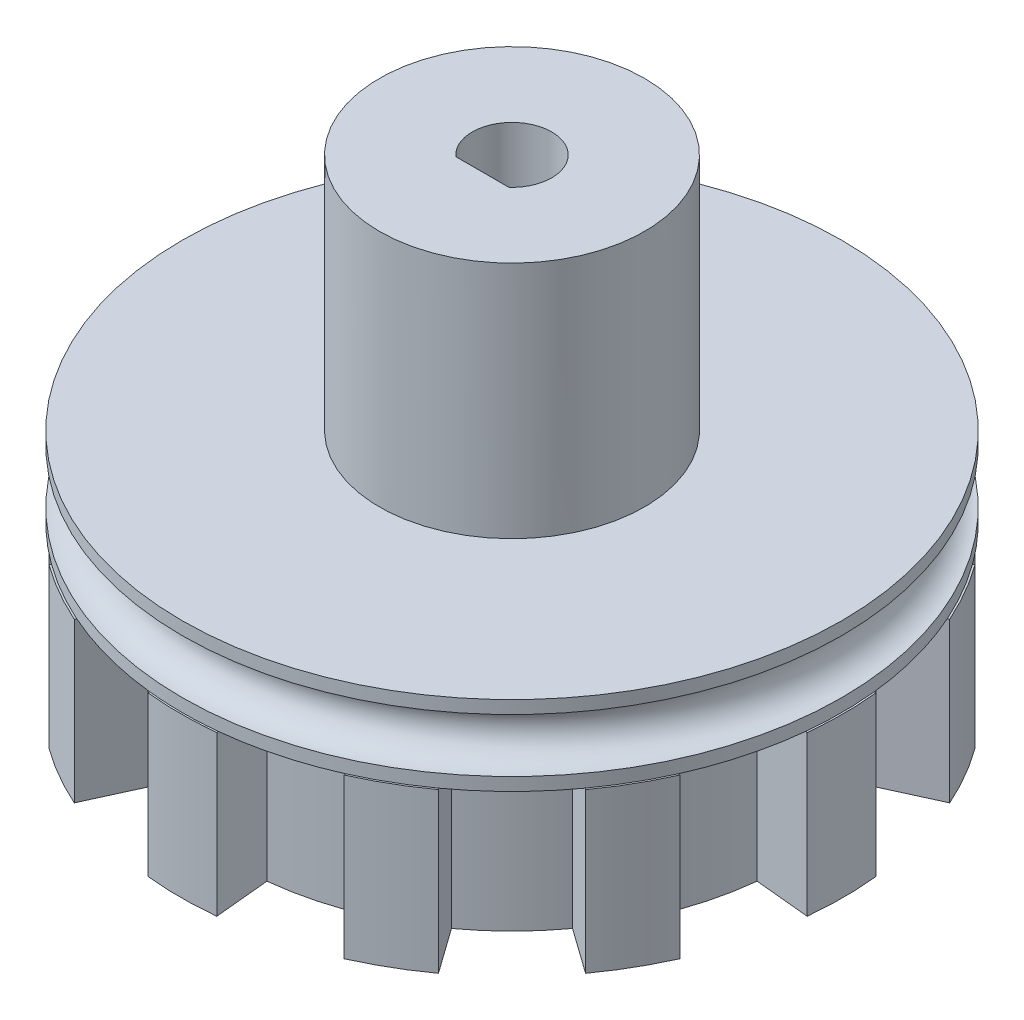
from build123d import *

# Parameters (mm, degrees)
EXTRUDE_1_DEPTH     = 6
SKETCH_3_R          = 1.4
CUT_EXTRUDE_1_DEPTH = 6
SKETCH_4_R          = 5
EXTRUDE_2_DEPTH     = 12
CUT_EXTRUDE_2_DEPTH = 12


with BuildPart() as part:
    # 草图2 → 凸台-拉伸1 (new body)
    with BuildSketch(Plane(origin=(0, 0, 0), x_dir=(1, 0, 0), z_dir=(0, 1, 0))):
        with BuildLine():
            Line((-1.1, 10.341663309), (-1.3, 12.432216214))
            ThreePointArc((-1.3, 12.432216214), (0, 12.5), (1.3, 12.432216214))
            Line((1.3, 12.432216214), (1.1, 10.341663309))
            ThreePointArc((1.1, 10.341663309), (2.691718069, 10.045628593), (4.21820371, 9.506143143))
            Line((4.21820371, 9.506143143), (5.090275082, 11.416615067))
            ThreePointArc((5.090275082, 11.416615067), (6.25, 10.825317547), (7.341941132, 10.116615067))
            Line((7.341941132, 10.116615067), (6.123459599, 8.406143143))
            ThreePointArc((6.123459599, 8.406143143), (7.353910524, 7.353910524), (8.406143143, 6.123459599))
            Line((8.406143143, 6.123459599), (10.116615067, 7.341941132))
            ThreePointArc((10.116615067, 7.341941132), (10.825317547, 6.25), (11.416615067, 5.090275082))
            Line((11.416615067, 5.090275082), (9.506143143, 4.21820371))
            ThreePointArc((9.506143143, 4.21820371), (10.045628593, 2.691718069), (10.341663309, 1.1))
            Line((10.341663309, 1.1), (12.432216214, 1.3))
            ThreePointArc((12.432216214, 1.3), (12.5, 0), (12.432216214, -1.3))
            Line((12.432216214, -1.3), (10.341663309, -1.1))
            ThreePointArc((10.341663309, -1.1), (10.045628593, -2.691718069), (9.506143143, -4.21820371))
            Line((9.506143143, -4.21820371), (11.416615067, -5.090275082))
            ThreePointArc((11.416615067, -5.090275082), (10.825317547, -6.25), (10.116615067, -7.341941132))
            Line((10.116615067, -7.341941132), (8.406143143, -6.123459599))
            ThreePointArc((8.406143143, -6.123459599), (7.353910524, -7.353910524), (6.123459599, -8.406143143))
            Line((6.123459599, -8.406143143), (7.341941132, -10.116615067))
            ThreePointArc((7.341941132, -10.116615067), (6.25, -10.825317547), (5.090275082, -11.416615067))
            Line((5.090275082, -11.416615067), (4.21820371, -9.506143143))
            ThreePointArc((4.21820371, -9.506143143), (2.691718069, -10.045628593), (1.1, -10.341663309))
            Line((1.1, -10.341663309), (1.3, -12.432216214))
            ThreePointArc((1.3, -12.432216214), (0, -12.5), (-1.3, -12.432216214))
            Line((-1.3, -12.432216214), (-1.1, -10.341663309))
            ThreePointArc((-1.1, -10.341663309), (-2.691718069, -10.045628593), (-4.21820371, -9.506143143))
            Line((-4.21820371, -9.506143143), (-5.090275082, -11.416615067))
            ThreePointArc((-5.090275082, -11.416615067), (-6.25, -10.825317547), (-7.341941132, -10.116615067))
            Line((-7.341941132, -10.116615067), (-6.123459599, -8.406143143))
            ThreePointArc((-6.123459599, -8.406143143), (-7.353910524, -7.353910524), (-8.406143143, -6.123459599))
            Line((-8.406143143, -6.123459599), (-10.116615067, -7.341941132))
            ThreePointArc((-10.116615067, -7.341941132), (-10.825317547, -6.25), (-11.416615067, -5.090275082))
            Line((-11.416615067, -5.090275082), (-9.506143143, -4.21820371))
            ThreePointArc((-9.506143143, -4.21820371), (-10.045628593, -2.691718069), (-10.341663309, -1.1))
            Line((-10.341663309, -1.1), (-12.432216214, -1.3))
            ThreePointArc((-12.432216214, -1.3), (-12.5, 0), (-12.432216214, 1.3))
            Line((-12.432216214, 1.3), (-10.341663309, 1.1))
            ThreePointArc((-10.341663309, 1.1), (-10.045628593, 2.691718069), (-9.506143143, 4.21820371))
            Line((-9.506143143, 4.21820371), (-11.416615067, 5.090275082))
            ThreePointArc((-11.416615067, 5.090275082), (-10.825317547, 6.25), (-10.116615067, 7.341941132))
            Line((-10.116615067, 7.341941132), (-8.406143143, 6.123459599))
            ThreePointArc((-8.406143143, 6.123459599), (-7.353910524, 7.353910524), (-6.123459599, 8.406143143))
            Line((-6.123459599, 8.406143143), (-7.341941132, 10.116615067))
            ThreePointArc((-7.341941132, 10.116615067), (-6.25, 10.825317547), (-5.090275082, 11.416615067))
            Line((-5.090275082, 11.416615067), (-4.21820371, 9.506143143))
            ThreePointArc((-4.21820371, 9.506143143), (-2.691718069, 10.045628593), (-1.1, 10.341663309))
        make_face()
    extrude(amount=EXTRUDE_1_DEPTH)

    # 草图3 → 切除-拉伸1 (cut)
    with BuildSketch(Plane(origin=(0, 6, 0), x_dir=(1, 0, 0), z_dir=(0, 1, 0))):
        with Locations(Location((0, 0, 0), (0, 0, 270))):
            Circle(SKETCH_3_R)
    extrude(amount=-CUT_EXTRUDE_1_DEPTH, mode=Mode.SUBTRACT)

    # 草图4 → 凸台-拉伸2 (add)
    with BuildSketch(Plane(origin=(0, 6, 0), x_dir=(1, 0, 0), z_dir=(0, 1, 0))):
        with Locations(Location((0, 0, 0), (0, 0, 270))):
            Circle(SKETCH_4_R)
    extrude(amount=EXTRUDE_2_DEPTH)

    # 草图5 → 切除-拉伸2 (cut)
    with BuildSketch(Plane(origin=(0, 18, 0), x_dir=(1, 0, 0), z_dir=(0, 1, 0))):
        with BuildLine():
            Line((-1, -1.118033989), (1, -1.118033989))
            ThreePointArc((1, -1.118033989), (0, 1.5), (-1, -1.118033989))
        make_face()
    extrude(amount=-CUT_EXTRUDE_2_DEPTH, mode=Mode.SUBTRACT)

    # 草图7 → 旋转1 (revolve)
    with BuildSketch(Plane(origin=(0, 0, 0), x_dir=(0, 0, -1), z_dir=(1, 0, 0)), mode=Mode.PRIVATE) as revolve_1_sk:
        with BuildLine():
            Line((5, 9), (12.432216214, 9))
            Line((12.432216214, 9), (12.432216214, 8.511911797))
            ThreePointArc((12.432216214, 8.511911797), (11.390525649, 7.5), (12.432216214, 6.488088203))
            Line((12.432216214, 6.488088203), (12.432216214, 6))
            Line((12.432216214, 6), (5, 6))
            Line((5, 6), (5, 9))
        make_face()
    revolve(revolve_1_sk.sketch.rotate(Axis((0, 19.919763073, 0), (0, -1, 0)), 180), axis=Axis((0, 19.919763073, 0), (0, -1, 0)))


solid = part.part
